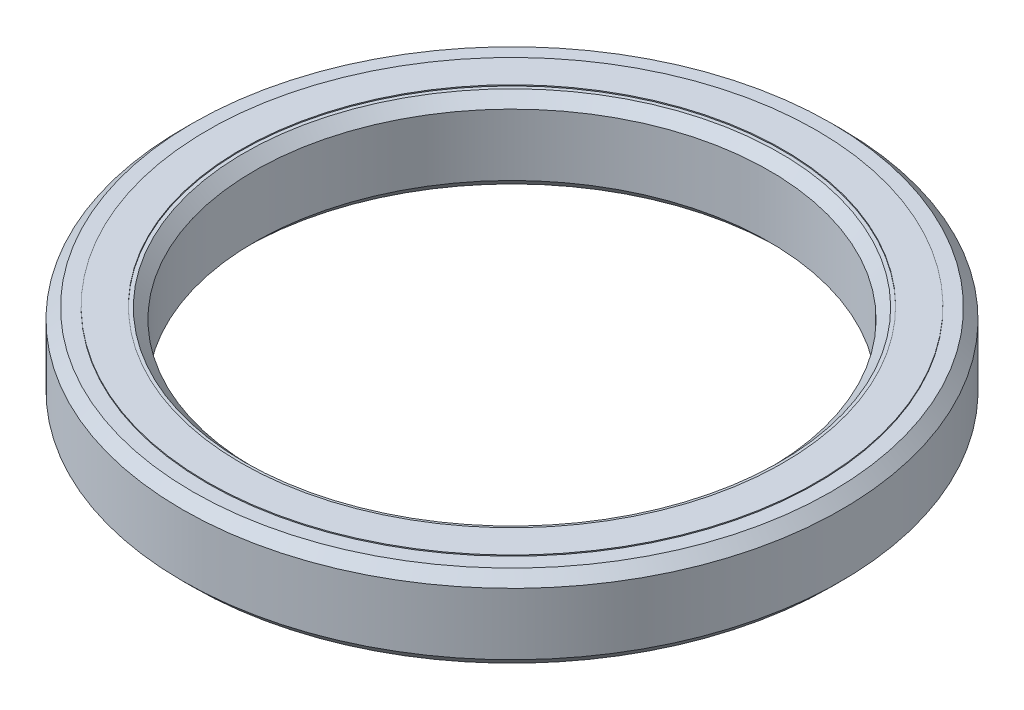
from build123d import *

# Parameters (mm, degrees)
CROQUIS1_R              = 16
CROQUIS1_R_2            = 12.5
SALIENTE_EXTRUIR1_DEPTH = 2
CHAFL_N1_SIZE           = 0.5
CROQUIS2_R              = 14.793460403
CROQUIS2_R_2            = 13.169701353
SALIENTE_EXTRUIR2_DEPTH = 2.05


with BuildPart() as part:
    # Croquis1 → Saliente-Extruir1 (new, symmetric)
    with BuildSketch(Plane(origin=(0, 0, 0), x_dir=(1, 0, 0), z_dir=(0, 1, 0))):
        with Locations(Location((0, 0, 0), (0, 0, 270))):
            Circle(CROQUIS1_R)
        with Locations(Location((0, 0, 0), (0, 0, 270))):
            Circle(CROQUIS1_R_2, mode=Mode.SUBTRACT)
    extrude(amount=SALIENTE_EXTRUIR1_DEPTH, both=True)

    # Chaflán1
    chafl_n1_edges = [part.edges().sort_by_distance(p)[0] for p in [
        (0, -2, -16),
        (0, 2, -16),
        (0, -2, -12.5),
        (0, 2, -12.5),
    ]]
    chamfer(chafl_n1_edges, length=CHAFL_N1_SIZE)

    # Croquis2 → Saliente-Extruir2 (add, symmetric)
    with BuildSketch(Plane(origin=(0, 0, 0), x_dir=(1, 0, 0), z_dir=(0, 1, 0))):
        with Locations(Location((0, 0, 0), (0, 0, 270))):
            Circle(CROQUIS2_R)
        with Locations(Location((0, 0, 0), (0, 0, 270))):
            Circle(CROQUIS2_R_2, mode=Mode.SUBTRACT)
    extrude(amount=SALIENTE_EXTRUIR2_DEPTH, both=True)


solid = part.part
